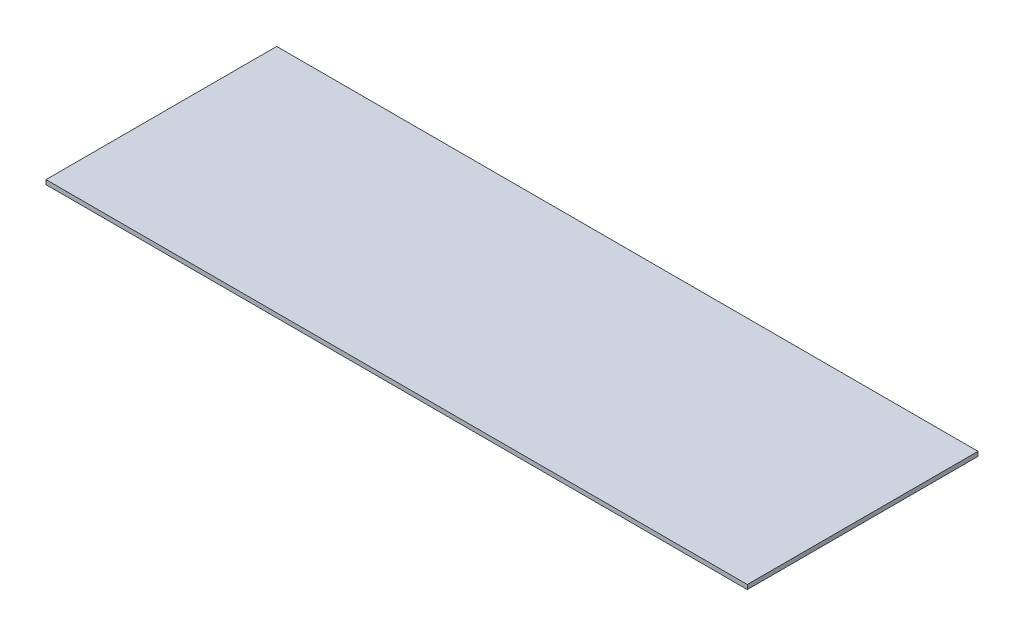
from build123d import *

# Parameters (mm, degrees)
SKETCH1_W           = 202.692
SKETCH1_H           = 66.675
BOSS_EXTRUDE1_DEPTH = 1.27


with BuildPart() as part:
    # Sketch1 → Boss-Extrude1 (new body)
    with BuildSketch(Plane(origin=(0, 0, 0), x_dir=(1, 0, 0), z_dir=(0, 1, 0))):
        with Locations((101.346, 33.3375)):
            Rectangle(SKETCH1_W, SKETCH1_H)
    extrude(amount=BOSS_EXTRUDE1_DEPTH)


solid = part.part
